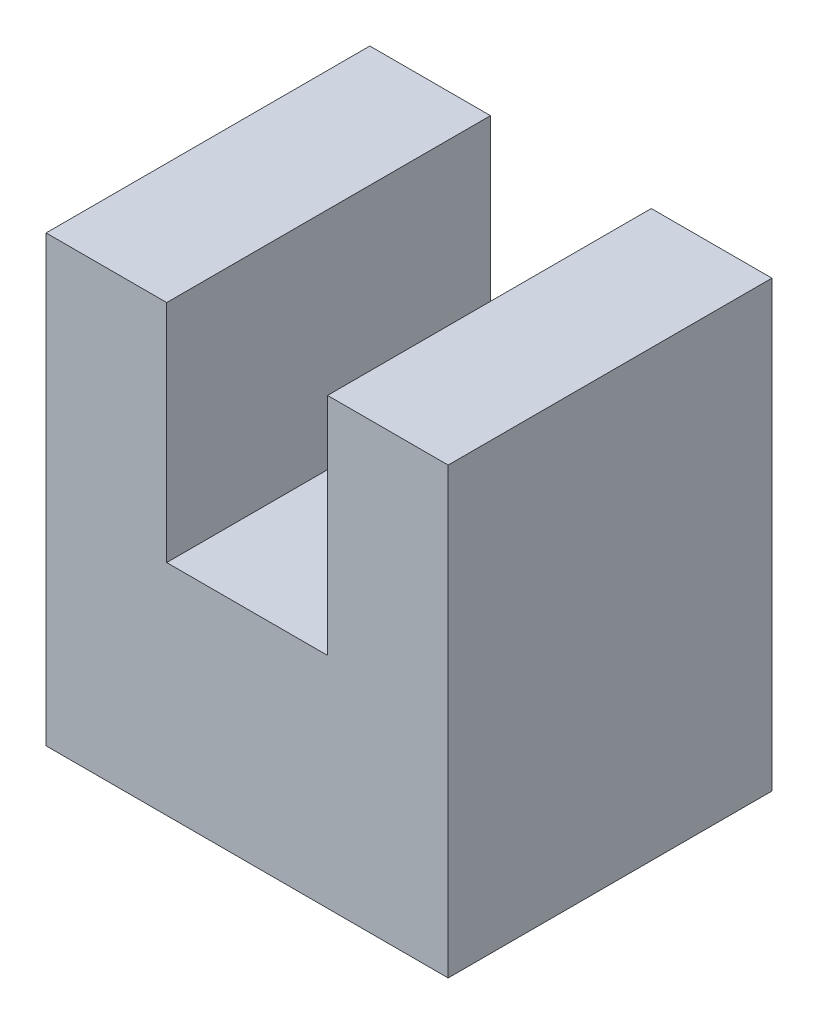
from build123d import *

# Parameters (mm, degrees)
SKETCH1_W           = 5
SKETCH1_H           = 1.524
BOSS_EXTRUDE1_DEPTH = 4.0259


with BuildPart() as part:
    # Sketch1 → Boss-Extrude1 (new body)
    with BuildSketch(Plane.XY):
        Polygon((-1, 1.962), (-1, 4.762), (-2.5, 4.762), (-2.5, 0.762), (2.5, 0.762), (2.5, 4.762), (1, 4.762), (1, 1.962), align=None)
        Rectangle(SKETCH1_W, SKETCH1_H)
    extrude(amount=BOSS_EXTRUDE1_DEPTH)


solid = part.part
